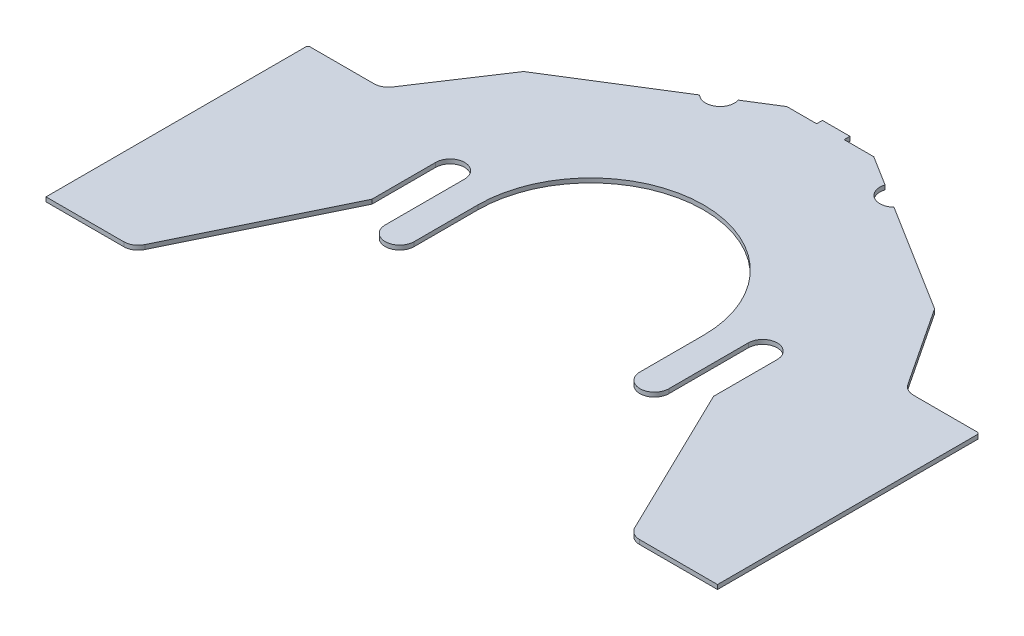
from build123d import *

# Parameters (mm, degrees)
BOSS_EXTRUDE1_DEPTH = 1.5


with BuildPart() as part:
    # Sketch1 → Boss-Extrude1 (new body)
    with BuildSketch(Plane(origin=(0, 0, 0), x_dir=(1, 0, 0), z_dir=(0, 1, 0))):
        with BuildLine():
            Line((15, 0), (4.75, 0))
            Line((4.75, 0), (4.75, 2))
            Line((4.75, 2), (-4.75, 2))
            Line((-4.75, 2), (-4.75, 0))
            Line((-4.75, 0), (-15, 0))
            Line((-15, 0), (-25.356589319, -6.472868325))
            ThreePointArc((-25.356589319, -6.472868325), (-27.468846161, -12.236329652), (-33.575081251, -11.609425782))
            Line((-33.575081251, -11.609425782), (-71, -35))
            Line((-71, -35), (-89.017448096, -62.257165069))
            ThreePointArc((-89.017448096, -62.257165069), (-90.820615058, -63.903738488), (-93.18854397, -64.5))
            Line((-93.18854397, -64.5), (-115.5, -64.5))
            Line((-115.5, -64.5), (-116, -65))
            Line((-116, -65), (-116, -155))
            Line((-116, -155), (-89.131068486, -155))
            ThreePointArc((-89.131068486, -155), (-86.477376272, -154.23767833), (-84.632870889, -152.183167051))
            Line((-84.632870889, -152.183167051), (-59, -99.369197466))
            Line((-59, -99.369197466), (-59, -77.369197466))
            ThreePointArc((-59, -77.369197466), (-54, -72.369197466), (-49, -77.369197466))
            Line((-49, -77.369197466), (-49, -104.800858216))
            ThreePointArc((-49, -104.800858216), (-44, -109.800858216), (-39, -104.800858216))
            Line((-39, -104.800858216), (-39, -82.800858216))
            ThreePointArc((-39, -82.800858216), (0, -43.800858216), (39, -82.800858216))
            Line((39, -82.800858216), (39, -104.800858216))
            ThreePointArc((39, -104.800858216), (44, -109.800858216), (49, -104.800858216))
            Line((49, -104.800858216), (49, -77.369197466))
            ThreePointArc((49, -77.369197466), (54, -72.369197466), (59, -77.369197466))
            Line((59, -77.369197466), (59, -99.369197466))
            Line((59, -99.369197466), (84.632870889, -152.183167051))
            ThreePointArc((84.632870889, -152.183167051), (86.477376272, -154.23767833), (89.131068486, -155))
            Line((89.131068486, -155), (116, -155))
            Line((116, -155), (116, -65))
            Line((116, -65), (115.5, -64.5))
            Line((115.5, -64.5), (93.18854397, -64.5))
            ThreePointArc((93.18854397, -64.5), (90.820615058, -63.903738488), (89.017448096, -62.257165069))
            Line((89.017448096, -62.257165069), (71, -35))
            Line((71, -35), (33.575081251, -11.609425782))
            ThreePointArc((33.575081251, -11.609425782), (27.468846161, -12.236329652), (25.356589319, -6.472868325))
            Line((25.356589319, -6.472868325), (15, 0))
        make_face()
    extrude(amount=BOSS_EXTRUDE1_DEPTH)


solid = part.part
